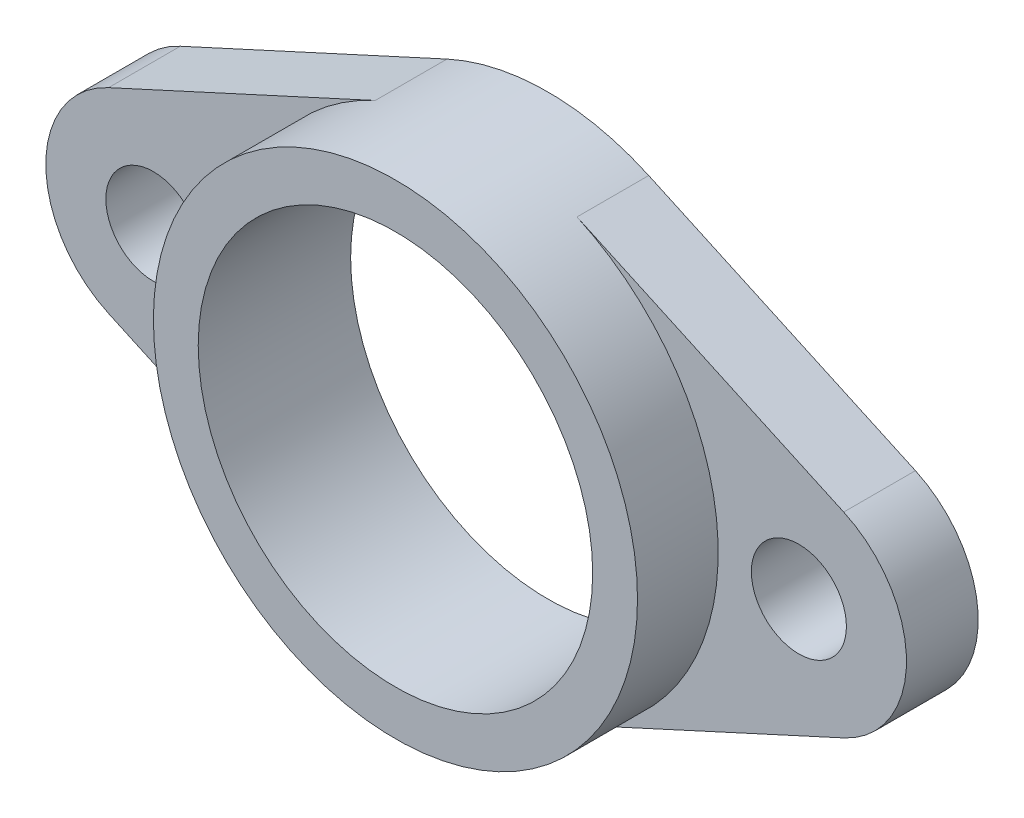
from build123d import *

# Parameters (mm, degrees)
BASE_SKETCH_R                     = 11
BASE_EXTRUDE_DEPTH                = 4
BEARING_RETAINING_RING_SKETCH_R   = 13.5
BEARING_RETAINING_RING_SKETCH_R_2 = 11
BEARING_RETAINING_RING_DEPTH      = 8.5
MOUNTING_HOLES_D                  = 5.3


with BuildPart() as part:
    # Base Sketch → Base Extrude (new body)
    with BuildSketch(Plane.XY):
        with BuildLine():
            Line((-20.5, 5.454356057), (-5.625, 12.272301129))
            ThreePointArc((-5.625, 12.272301129), (0, 13.5), (5.625, 12.272301129))
            Line((5.625, 12.272301129), (20.5, 5.454356057))
            ThreePointArc((20.5, 5.454356057), (24, 0), (20.5, -5.454356057))
            Line((20.5, -5.454356057), (5.625, -12.272301129))
            ThreePointArc((5.625, -12.272301129), (0, -13.5), (-5.625, -12.272301129))
            Line((-5.625, -12.272301129), (-20.5, -5.454356057))
            ThreePointArc((-20.5, -5.454356057), (-24, 0), (-20.5, 5.454356057))
        make_face()
        Circle(BASE_SKETCH_R, mode=Mode.SUBTRACT)
    extrude(amount=BASE_EXTRUDE_DEPTH)

    # Bearing Retaining Ring Sketch → Bearing Retaining Ring (add)
    with BuildSketch(Plane.XY):
        with Locations(Location((0, 0, 0), (0, 0, 114.624318352))):
            Circle(BEARING_RETAINING_RING_SKETCH_R)
        Circle(BEARING_RETAINING_RING_SKETCH_R_2, mode=Mode.SUBTRACT)
    extrude(amount=BEARING_RETAINING_RING_DEPTH)

    # Mounting Holes (through all)
    with Locations(Plane(origin=(0, 0, 0), x_dir=(-1, 0, 0), z_dir=(0, 0, -1))):
        with Locations((18, 0), (-18, 0)):
            Hole(MOUNTING_HOLES_D / 2)


solid = part.part
